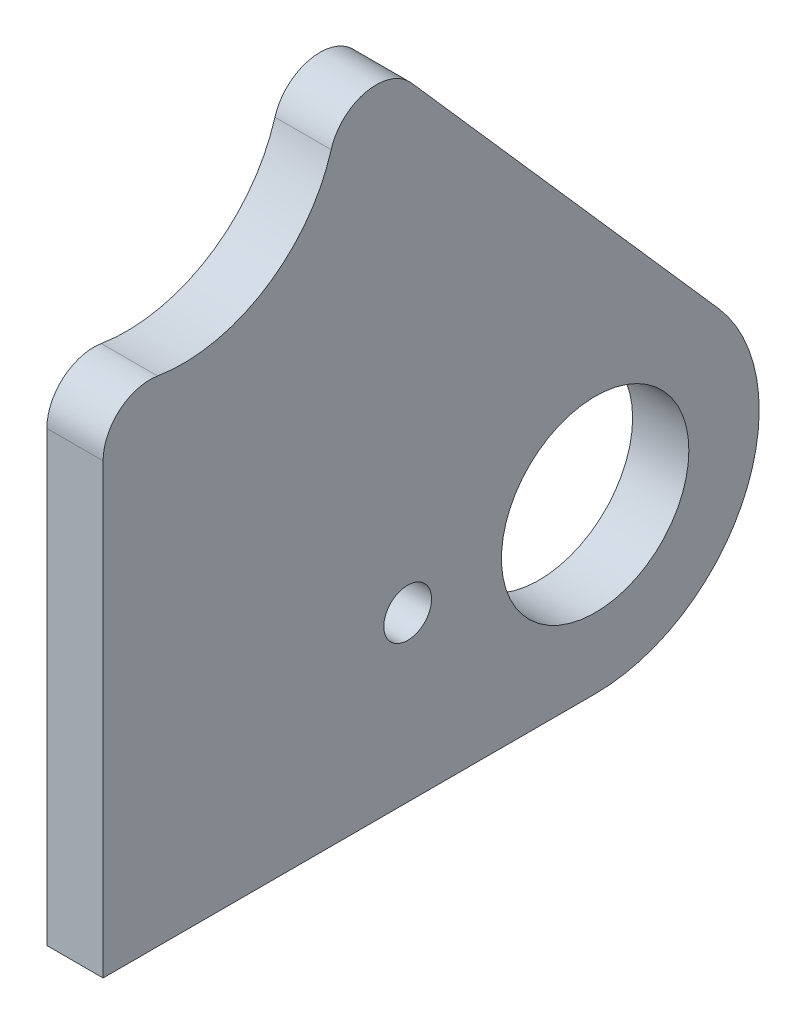
from build123d import *

# Parameters (mm, degrees)
SKETCH_1_R          = 20
EXTRUDE_1_DEPTH     = 12
FILLET_1_R          = 10
HOLE_WIZARD_M12_1_D = 10.2


with BuildPart() as part:
    # 草图1 → 凸台-拉伸1 (new body)
    with BuildSketch(Plane(origin=(0, 0, 0), x_dir=(0, 0, -1), z_dir=(1, 0, 0))):
        with BuildLine():
            Line((0, 0), (0, 109.715728753))
            ThreePointArc((0, 109.715728753), (42.343741696, 116.864845474), (41.770630196, 159.804033565))
            Line((41.770630196, 159.804033565), (131.271880511, 58.125490145))
            ThreePointArc((131.271880511, 58.125490145), (136.893511527, 20.584594266), (105, 0))
            Line((105, 0), (0, 0))
        make_face()
        with Locations((105, 35)):
            Circle(SKETCH_1_R, mode=Mode.SUBTRACT)
    extrude(amount=EXTRUDE_1_DEPTH)

    # 圆角1
    fillet_1_edges = [part.edges().sort_by_distance(p)[0] for p in [
        (6, 109.715728753, 0),
        (6, 159.804033565, -41.770630196),
    ]]
    fillet(fillet_1_edges, radius=FILLET_1_R)

    # M12 螺纹孔1 (through all)
    with Locations(Plane(origin=(12, 0, 0), x_dir=(0, 0, -1), z_dir=(1, 0, 0))):
        with Locations((65, 35)):
            Hole(HOLE_WIZARD_M12_1_D / 2)


solid = part.part
